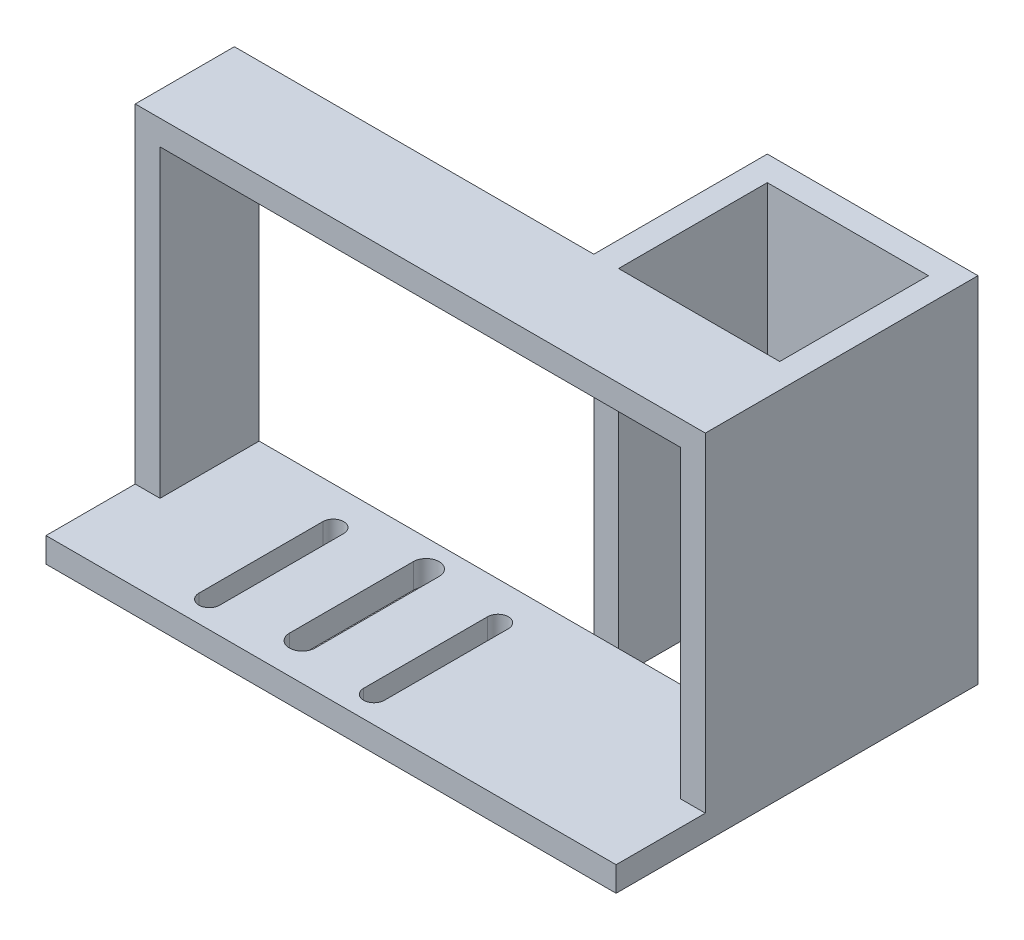
from build123d import *

# Parameters (mm, degrees)
SKETCH1_W           = 146.05
SKETCH1_H           = 90.678
SKETCH1_W_2         = 133.35
SKETCH1_H_2         = 77.978
BOSS_EXTRUDE1_DEPTH = 25.4
SKETCH2_W           = 60.325
SKETCH2_H           = 22.86
BOSS_EXTRUDE2_DEPTH = 6.35
CUT_EXTRUDE1_REACH  = 123.544
SKETCH6_W           = 53.975
SKETCH6_H           = 90.678
BOSS_EXTRUDE3_DEPTH = 44.45
CUT_EXTRUDE3_REACH  = 128.032
SKETCH8_W           = 41.275
SKETCH8_H           = 38.1


with BuildPart() as part:
    # Sketch1 → Boss-Extrude1 (new body)
    with BuildSketch(Plane.XY):
        Rectangle(SKETCH1_W, SKETCH1_H)
        Rectangle(SKETCH1_W_2, SKETCH1_H_2, mode=Mode.SUBTRACT)
    extrude(amount=BOSS_EXTRUDE1_DEPTH)

    # Sketch2 → Boss-Extrude2 (add)
    with BuildSketch(Plane(origin=(0, -45.339, 0), x_dir=(1, 0, 0), z_dir=(0, 1, 0))):
        Polygon((-40.513, -48.26), (-40.513, -25.4), (-73.025, -25.4), align=None)
        with Locations((-10.3505, -36.83)):
            Rectangle(SKETCH2_W, SKETCH2_H)
        Polygon((73.025, -25.4), (19.812, -25.4), (19.812, -48.26), align=None)
        Polygon((-73.025, -48.26), (-40.513, -48.26), (-73.025, -25.4), align=None)
        Polygon((73.025, -25.4), (19.812, -48.26), (73.025, -48.26), align=None)
    extrude(amount=BOSS_EXTRUDE2_DEPTH)

    # Sketch5 → Cut-Extrude1 (cut, up to next)
    with BuildSketch(Plane(origin=(0, -38.989, 0), x_dir=(1, 0, 0), z_dir=(0, 1, 0)), mode=Mode.PRIVATE) as cut_extrude1_sk1:
        with BuildLine():
            Line((-20.193, -38.735), (-20.193, -6.985))
            ThreePointArc((-20.193, -6.985), (-16.891, -3.683), (-13.589, -6.985))
            Line((-13.589, -6.985), (-13.589, -38.735))
            ThreePointArc((-13.589, -38.735), (-16.891, -42.037), (-20.193, -38.735))
        make_face()
    cut_extrude1_tool1 = extrude(cut_extrude1_sk1.sketch, amount=-CUT_EXTRUDE1_REACH, mode=Mode.PRIVATE) & part.part
    # Sketch5 → Cut-Extrude1 (cut, up to next)
    with BuildSketch(Plane(origin=(0, -38.989, 0), x_dir=(1, 0, 0), z_dir=(0, 1, 0)), mode=Mode.PRIVATE) as cut_extrude1_sk2:
        with BuildLine():
            Line((6.87705, -9.707286463), (6.87705, -41.457286463))
            ThreePointArc((6.87705, -41.457286463), (4.21005, -44.124286463), (1.54305, -41.457286463))
            Line((1.54305, -41.457286463), (1.54305, -9.707286463))
            ThreePointArc((1.54305, -9.707286463), (4.21005, -7.040286463), (6.87705, -9.707286463))
        make_face()
    cut_extrude1_tool2 = extrude(cut_extrude1_sk2.sketch, amount=-CUT_EXTRUDE1_REACH, mode=Mode.PRIVATE) & part.part
    # Sketch5 → Cut-Extrude1 (cut, up to next)
    with BuildSketch(Plane(origin=(0, -38.989, 0), x_dir=(1, 0, 0), z_dir=(0, 1, 0)), mode=Mode.PRIVATE) as cut_extrude1_sk3:
        with BuildLine():
            Line((-40.65905, -9.707286463), (-40.65905, -41.457286463))
            ThreePointArc((-40.65905, -41.457286463), (-37.99205, -44.124286463), (-35.32505, -41.457286463))
            Line((-35.32505, -41.457286463), (-35.32505, -9.707286463))
            ThreePointArc((-35.32505, -9.707286463), (-37.99205, -7.040286463), (-40.65905, -9.707286463))
        make_face()
    cut_extrude1_tool3 = extrude(cut_extrude1_sk3.sketch, amount=-CUT_EXTRUDE1_REACH, mode=Mode.PRIVATE) & part.part
    add(cut_extrude1_tool1.solids().sort_by_distance((-16.891, -38.989, 22.86))[0], mode=Mode.SUBTRACT)
    add(cut_extrude1_tool2.solids().sort_by_distance((4.21005, -38.989, 25.582286))[0], mode=Mode.SUBTRACT)
    add(cut_extrude1_tool3.solids().sort_by_distance((-37.99205, -38.989, 25.582286))[0], mode=Mode.SUBTRACT)

    # Sketch6 → Boss-Extrude3 (add)
    with BuildSketch(Plane(origin=(0, 0, 0), x_dir=(-1, 0, 0), z_dir=(0, 0, -1))):
        with Locations((-46.0375, 0)):
            Rectangle(SKETCH6_W, SKETCH6_H)
    extrude(amount=BOSS_EXTRUDE3_DEPTH)

    # Sketch8 → Cut-Extrude3 (cut, up to next)
    with BuildSketch(Plane(origin=(0, 45.339, 0), x_dir=(1, 0, 0), z_dir=(0, 1, 0)), mode=Mode.PRIVATE) as cut_extrude3_sk1:
        with Locations((46.0375, 19.05)):
            Rectangle(SKETCH8_W, SKETCH8_H)
    cut_extrude3_tool1 = extrude(cut_extrude3_sk1.sketch, amount=-CUT_EXTRUDE3_REACH, mode=Mode.PRIVATE) & part.part
    add(cut_extrude3_tool1.solids().sort_by_distance((46.0375, 45.339, -19.05))[0], mode=Mode.SUBTRACT)


solid = part.part
